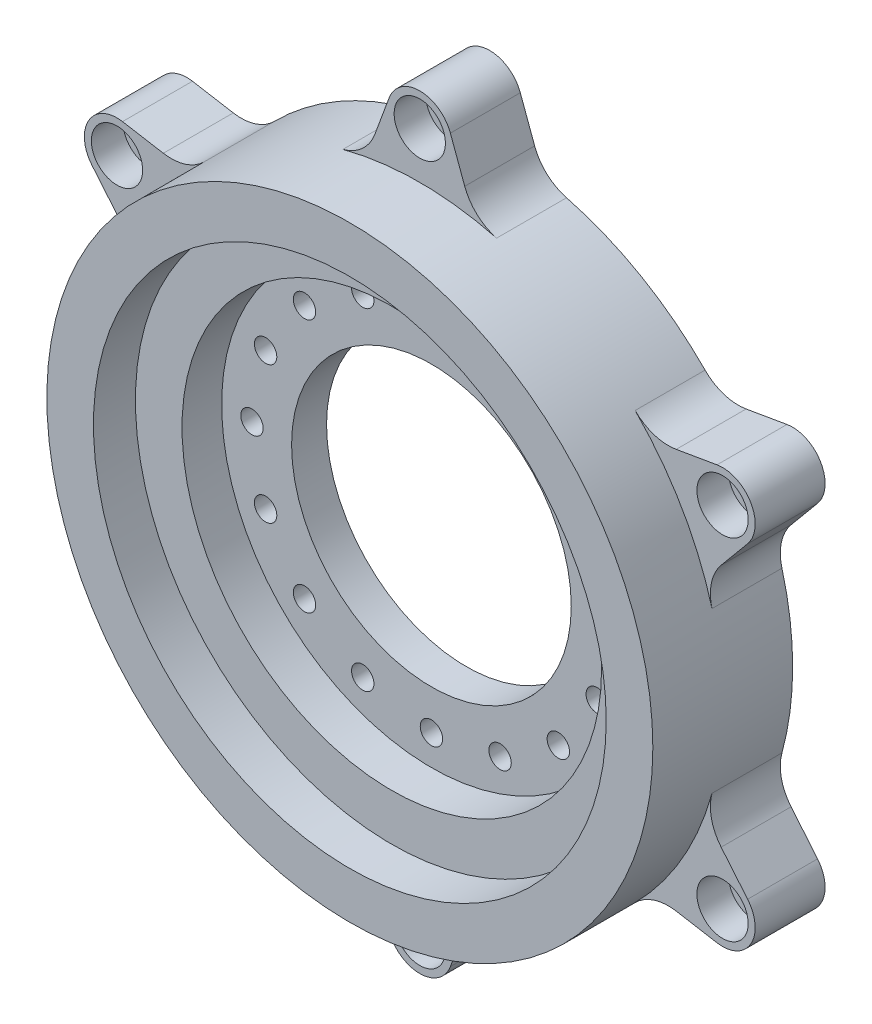
from build123d import *

# Parameters (mm, degrees)
SKETCH_1_R                = 65
EXTRUDE_1_DEPTH           = 30
SKETCH_2_R                = 55
CUT_EXTRUDE_1_DEPTH       = 9
SKETCH_3_R                = 45
CUT_EXTRUDE_2_DEPTH       = 8.5
SKETCH_4_R                = 30
CUT_EXTRUDE_3_DEPTH       = 8.5
CUT_EXTRUDE_START         = -5
SKETCH_5_R                = 45
CUT_EXTRUDE_4_DEPTH       = 5
HOLE_WIZARD_1_D           = 4.8
HOLE_WIZARD_1_CBORE_D     = 8
HOLE_WIZARD_1_CBORE_DEPTH = 1
PATTERN_CIRCULAR_1_COUNT  = 16
EXTRUDE_2_DEPTH           = 15
HOLE_WIZARD_2_D           = 7
HOLE_WIZARD_2_CBORE_D     = 11
HOLE_WIZARD_2_CBORE_DEPTH = 6.8
PATTERN_CIRCULAR_2_COUNT  = 6


with BuildPart() as part:
    # 草图1 → 凸台-拉伸1 (new body)
    with BuildSketch(Plane.XY):
        Circle(SKETCH_1_R)
    extrude(amount=EXTRUDE_1_DEPTH)

    # 草图2 → 切除-拉伸1 (cut)
    with BuildSketch(Plane.XY.offset(30)):
        Circle(SKETCH_2_R)
    extrude(amount=-CUT_EXTRUDE_1_DEPTH, mode=Mode.SUBTRACT)

    # 草图3 → 切除-拉伸2 (cut)
    with BuildSketch(Plane.XY.offset(21)):
        Circle(SKETCH_3_R)
    extrude(amount=-CUT_EXTRUDE_2_DEPTH, mode=Mode.SUBTRACT)

    # 草图4 → 切除-拉伸3 (cut)
    with BuildSketch(Plane.XY.offset(12.5)):
        Circle(SKETCH_4_R)
    extrude(amount=-CUT_EXTRUDE_3_DEPTH, mode=Mode.SUBTRACT)

    # 草图5 → 切除-拉伸4 (cut)
    with BuildSketch(Plane(origin=(0, 0, 0), x_dir=(-1, 0, 0), z_dir=(0, 0, -1)).offset(CUT_EXTRUDE_START)):
        Circle(SKETCH_5_R)
    extrude(amount=CUT_EXTRUDE_4_DEPTH, mode=Mode.SUBTRACT)

    # 打孔尺寸(%根据)内六角圆柱头螺钉的类型1 (through all)
    with Locations(Plane(origin=(0, 0, 5), x_dir=(-1, 0, 0), z_dir=(0, 0, -1))):
        with Locations((0, 38.5)):
            hole_wizard_1 = CounterBoreHole(HOLE_WIZARD_1_D / 2, HOLE_WIZARD_1_CBORE_D / 2, HOLE_WIZARD_1_CBORE_DEPTH)

    # 阵列(圆周)1: 打孔尺寸(%根据)内六角圆柱头螺钉的类型1 ×16 about axis
    pattern_circular_1_axis = Axis((0, 0, 30), (0, 0, -1))
    for i in range(1, PATTERN_CIRCULAR_1_COUNT):
        add(hole_wizard_1.rotate(pattern_circular_1_axis, i * 360 / PATTERN_CIRCULAR_1_COUNT), mode=Mode.SUBTRACT)

    # 草图9 → 凸台-拉伸2 (add)
    with BuildSketch(Plane(origin=(0, 0, 0), x_dir=(-1, 0, 0), z_dir=(0, 0, -1))):
        with BuildLine():
            Line((-6.567411783, 77.422623055), (-9.642643143, 69.086076176))
            ThreePointArc((-9.642643143, 69.086076176), (-12.304478409, 65.141619558), (-16.488038646, 62.874037421))
            ThreePointArc((-16.488038646, 62.874037421), (0, 65), (16.488038646, 62.874037421))
            ThreePointArc((16.488038646, 62.874037421), (12.304478409, 65.141619558), (9.642643143, 69.086076176))
            Line((9.642643143, 69.086076176), (6.567411783, 77.422623055))
            ThreePointArc((6.567411783, 77.422623055), (0, 82), (-6.567411783, 77.422623055))
        make_face()
    extrude_2 = extrude(amount=-EXTRUDE_2_DEPTH)

    # 打孔尺寸(%根据)内六角圆柱头螺钉的类型2 (through all)
    with Locations(Plane.XY.offset(15)):
        with Locations((0, 75)):
            hole_wizard_2 = CounterBoreHole(HOLE_WIZARD_2_D / 2, HOLE_WIZARD_2_CBORE_D / 2, HOLE_WIZARD_2_CBORE_DEPTH)

    # 阵列(圆周)2: 凸台-拉伸2, 打孔尺寸(%根据)内六角圆柱头螺钉的类型2 ×6 about axis
    pattern_circular_2_axis = Axis((0, 0, 30), (0, 0, -1))
    add([extrude_2.rotate(pattern_circular_2_axis, i * 360 / PATTERN_CIRCULAR_2_COUNT) for i in range(1, PATTERN_CIRCULAR_2_COUNT)])
    add([hole_wizard_2.rotate(pattern_circular_2_axis, i * 360 / PATTERN_CIRCULAR_2_COUNT) for i in range(1, PATTERN_CIRCULAR_2_COUNT)], mode=Mode.SUBTRACT)


solid = part.part
